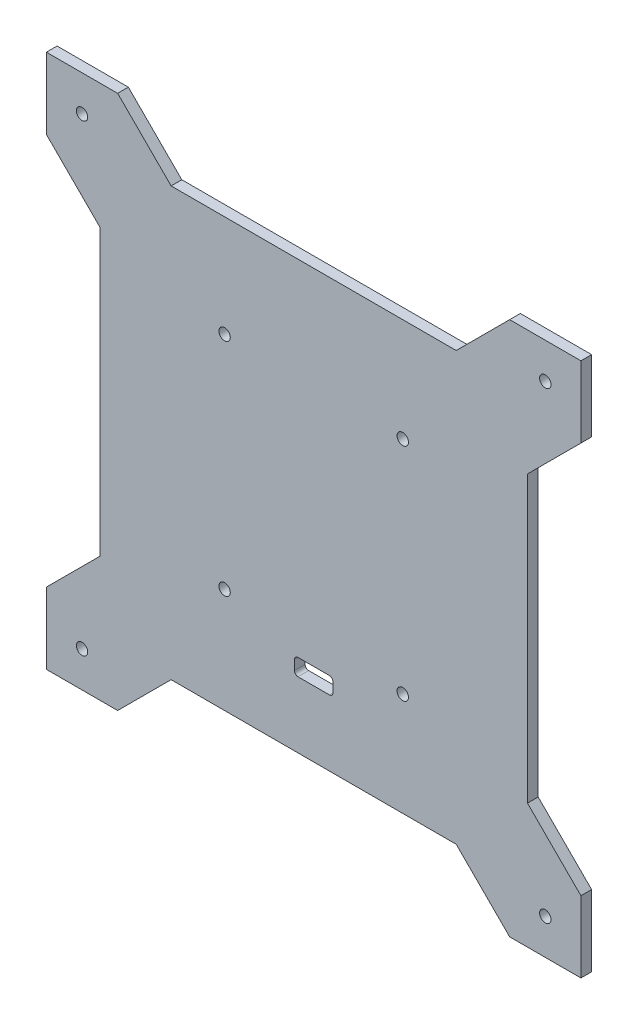
from build123d import *

# Parameters (mm, degrees)
SKETCH_1_W          = 150
SKETCH_1_H          = 150
SKETCH_1_R          = 1.6
EXTRUDE_1_DEPTH     = 3
SKETCH_2_R          = 1.6
CUT_EXTRUDE_1_DEPTH = 3
CUT_EXTRUDE_2_DEPTH = 3


with BuildPart() as part:
    # 草图1 → 凸台-拉伸1 (new body)
    with BuildSketch(Plane.XY):
        Rectangle(SKETCH_1_W, SKETCH_1_H)
        with Locations((-65, 65)):
            Circle(SKETCH_1_R, mode=Mode.SUBTRACT)
        with Locations((65, 65)):
            Circle(SKETCH_1_R, mode=Mode.SUBTRACT)
        with Locations((-65, -65)):
            Circle(SKETCH_1_R, mode=Mode.SUBTRACT)
        with Locations((65, -65)):
            Circle(SKETCH_1_R, mode=Mode.SUBTRACT)
    extrude(amount=EXTRUDE_1_DEPTH)

    # 草图2 → 切除-拉伸1 (cut)
    with BuildSketch(Plane.XY.offset(3)):
        with Locations((-25, -30.505222727)):
            Circle(SKETCH_2_R)
        with Locations((25, -31)):
            Circle(SKETCH_2_R)
        with Locations((25, 31)):
            Circle(SKETCH_2_R)
        with Locations((-25, 31.466039431)):
            Circle(SKETCH_2_R)
        Polygon((75, -55), (75, 55), (60, 40), (60, -40), align=None)
        Polygon((-55, 75), (-40, 60), (40, 60), (55, 75), align=None)
        Polygon((-75, -55), (-60, -40), (-60, 40), (-75, 55), align=None)
        Polygon((-55, -75), (55, -75), (40, -60), (-40, -60), align=None)
    extrude(amount=-CUT_EXTRUDE_1_DEPTH, mode=Mode.SUBTRACT)

    # 草图3 → 切除-拉伸2 (cut)
    with BuildSketch(Plane.XY.offset(3)):
        with BuildLine():
            Line((-5.4, -40.487301924), (-5.4, -37.787301924))
            ThreePointArc((-5.4, -37.787301924), (-5.107106781, -37.080195143), (-4.4, -36.787301924))
            Line((-4.4, -36.787301924), (4.4, -36.787301924))
            ThreePointArc((4.4, -36.787301924), (5.107106781, -37.080195143), (5.4, -37.787301924))
            Line((5.4, -37.787301924), (5.4, -40.487301924))
            ThreePointArc((5.4, -40.487301924), (5.107106781, -41.194408705), (4.4, -41.487301924))
            Line((4.4, -41.487301924), (-4.4, -41.487301924))
            ThreePointArc((-4.4, -41.487301924), (-5.107106781, -41.194408705), (-5.4, -40.487301924))
        make_face()
    extrude(amount=-CUT_EXTRUDE_2_DEPTH, mode=Mode.SUBTRACT)


solid = part.part
